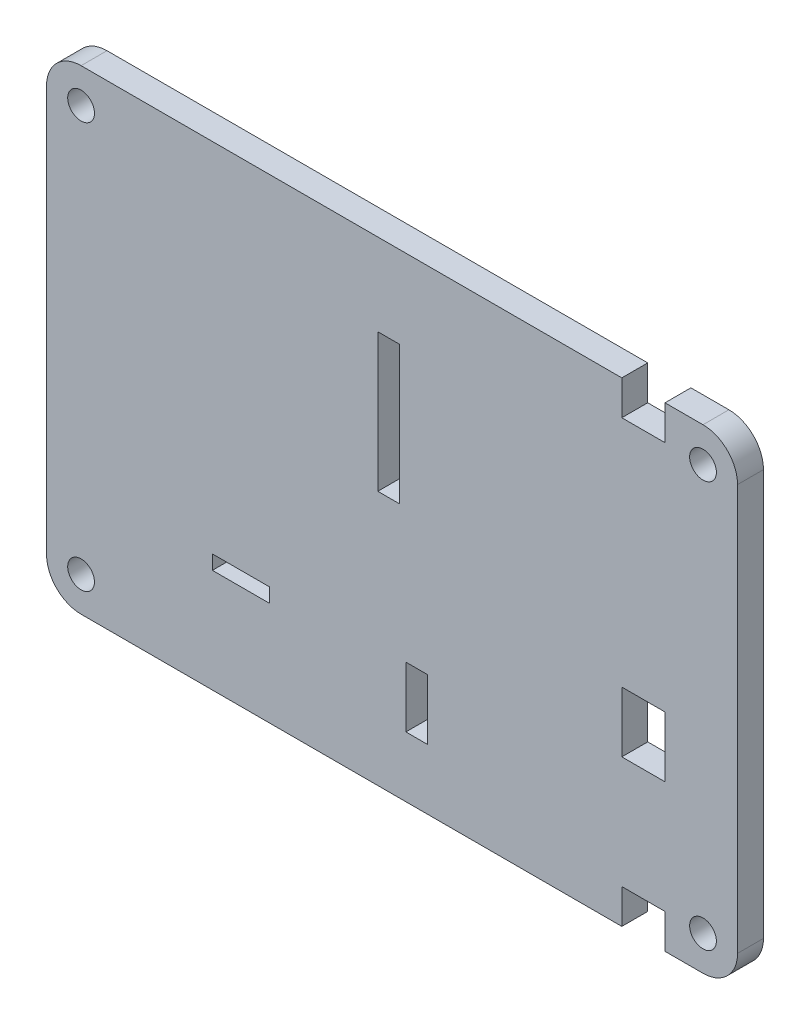
from build123d import *

# Parameters (mm, degrees)
ESQUISSE1_R        = 1.55
ESQUISSE1_W        = 5
ESQUISSE1_H        = 7
ESQUISSE1_W_2      = 2.5
ESQUISSE1_H_2      = 16
ESQUISSE1_W_3      = 6.6
ESQUISSE1_H_3      = 1.65
BOSS_EXTRU_1_DEPTH = 3


with BuildPart() as part:
    # Esquisse1 → Boss.-Extru.1 (new body)
    with BuildSketch(Plane.XY):
        with BuildLine():
            Line((26.6, 27.5), (-36, 27.5))
            ThreePointArc((-36, 27.5), (-38.828427125, 26.328427125), (-40, 23.5))
            Line((-40, 23.5), (-40, -23.5))
            ThreePointArc((-40, -23.5), (-38.828427125, -26.328427125), (-36, -27.5))
            Line((-36, -27.5), (26.6, -27.5))
            Line((26.6, -27.5), (26.6, -23.5))
            Line((26.6, -23.5), (31.6, -23.5))
            Line((31.6, -23.5), (31.6, -27.5))
            Line((31.6, -27.5), (36, -27.5))
            ThreePointArc((36, -27.5), (38.828427125, -26.328427125), (40, -23.5))
            Line((40, -23.5), (40, 23.5))
            ThreePointArc((40, 23.5), (38.828427125, 26.328427125), (36, 27.5))
            Line((36, 27.5), (31.6, 27.5))
            Line((31.6, 27.5), (31.6, 23.5))
            Line((31.6, 23.5), (26.6, 23.5))
            Line((26.6, 23.5), (26.6, 27.5))
        make_face()
        with Locations((-36, -23.5)):
            Circle(ESQUISSE1_R, mode=Mode.SUBTRACT)
        with Locations((-36, 23.5)):
            Circle(ESQUISSE1_R, mode=Mode.SUBTRACT)
        with Locations((36, 23.5)):
            Circle(ESQUISSE1_R, mode=Mode.SUBTRACT)
        with Locations((36, -23.5)):
            Circle(ESQUISSE1_R, mode=Mode.SUBTRACT)
        with Locations((29.1, -7)):
            Rectangle(ESQUISSE1_W, ESQUISSE1_H, mode=Mode.SUBTRACT)
        with Locations((-0.4, 10)):
            Rectangle(ESQUISSE1_W_2, ESQUISSE1_H_2, mode=Mode.SUBTRACT)
        with Locations((-17.5, -14.675)):
            Rectangle(ESQUISSE1_W_3, ESQUISSE1_H_3, mode=Mode.SUBTRACT)
        with Locations((2.85, -17)):
            Rectangle(ESQUISSE1_W_2, ESQUISSE1_H, mode=Mode.SUBTRACT)
    extrude(amount=BOSS_EXTRU_1_DEPTH)


solid = part.part
